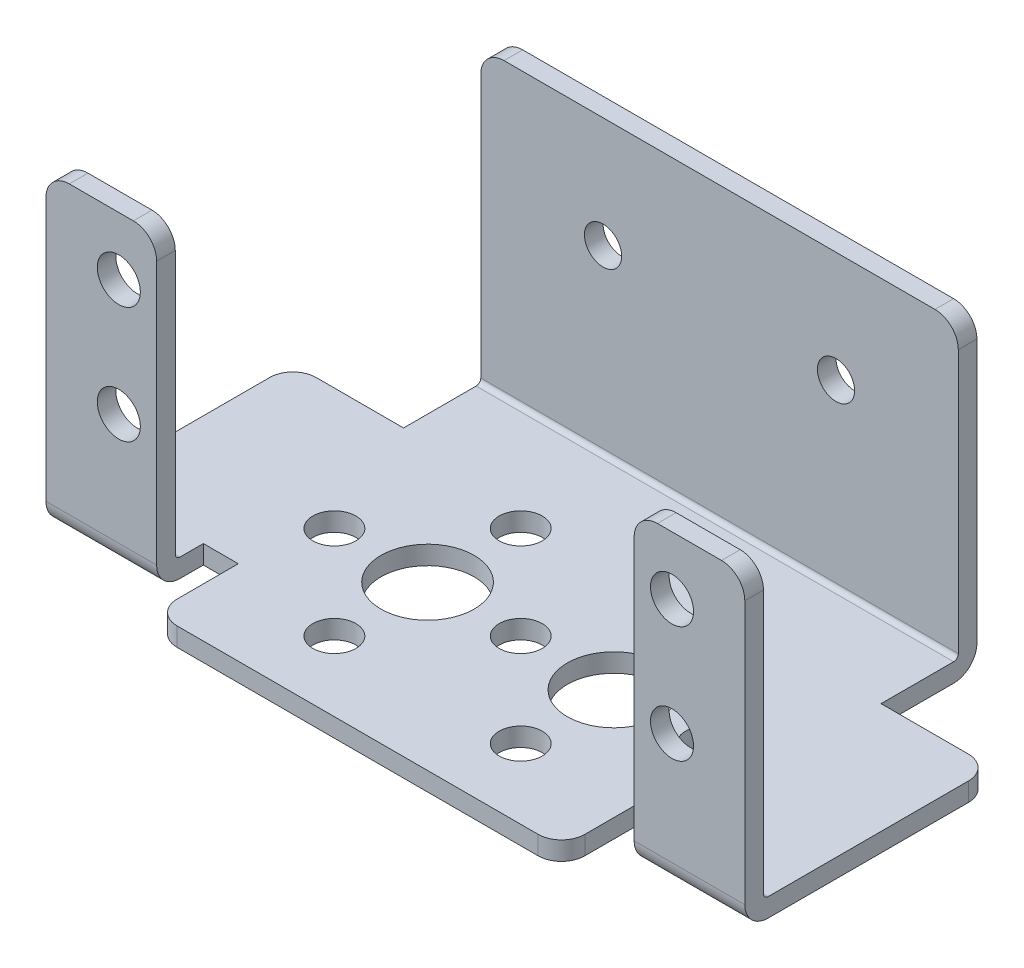
from build123d import *

# Parameters (mm, degrees)
SKETCH1_W                      = 26.6
SKETCH1_H                      = 29.43
BOSS_EXTRUDE1_DEPTH            = 9.5
SKETCH2_W                      = 27.83
SKETCH2_H                      = 25
CUT_EXTRUDE1_DEPTH             = 34.858217614
SKETCH3_W                      = 25.42
SKETCH3_H                      = 1.6
BOSS_EXTRUDE2_DEPTH            = 50.5
SKETCH4_W                      = 9.5
SKETCH4_H                      = 1.6
BOSS_EXTRUDE3_DEPTH            = 4.01
SKETCH5_W                      = 9.5
SKETCH5_H                      = 1.6
BOSS_EXTRUDE4_DEPTH            = 25
SKETCH6_W                      = 9.5
SKETCH6_H                      = 8.23
CUT_EXTRUDE2_DEPTH             = 44.284742115
SKETCH7_W                      = 9.5
SKETCH7_H                      = 8.23
CUT_EXTRUDE3_DEPTH             = 44.284742115
SKETCH8_W                      = 41
SKETCH8_H                      = 1.6
BOSS_EXTRUDE5_DEPTH            = 25
SKETCH9_W                      = 35
SKETCH9_H                      = 1.6
BOSS_EXTRUDE6_DEPTH            = 7.25
F_3_7_3_7_DIAMETER_HOLE1_D     = 3.7
F_3_7_3_7_DIAMETER_HOLE1_DEPTH = 26.6
F_8_0_8_DIAMETER_HOLE1_D       = 8
F_8_0_8_DIAMETER_HOLE1_DEPTH   = 26.6
F_3_2_3_2_DIAMETER_HOLE1_D     = 3.2
F_3_2_3_2_DIAMETER_HOLE1_DEPTH = 32.67
F_3_7_3_7_DIAMETER_HOLE2_D     = 3.7
F_3_7_3_7_DIAMETER_HOLE2_DEPTH = 29.43
FILLET1_R                      = 0.4
FILLET2_R                      = 2


with BuildPart() as part:
    # Sketch1 → Boss-Extrude1 (new body)
    with BuildSketch(Plane(origin=(-30, 0, 0), x_dir=(0, -1, 0), z_dir=(-1, 0, 0))):
        with Locations((-13.3, -3.955)):
            Rectangle(SKETCH1_W, SKETCH1_H)
    extrude(amount=-BOSS_EXTRUDE1_DEPTH)

    # Sketch2 → Cut-Extrude1 (cut, through all)
    with BuildSketch(Plane(origin=(-20.5, 0, 0), x_dir=(0, 0, -1), z_dir=(1, 0, 0))):
        with Locations((4.755, 14.1)):
            Rectangle(SKETCH2_W, SKETCH2_H)
    extrude(amount=-CUT_EXTRUDE1_DEPTH, mode=Mode.SUBTRACT)

    # Sketch3 → Boss-Extrude2 (add)
    with BuildSketch(Plane(origin=(-20.5, 0, 0), x_dir=(0, 0, -1), z_dir=(1, 0, 0))):
        with Locations((5.96, 0.8)):
            Rectangle(SKETCH3_W, SKETCH3_H)
    extrude(amount=BOSS_EXTRUDE2_DEPTH)

    # Sketch4 → Boss-Extrude3 (add)
    with BuildSketch(Plane.XY.offset(6.75)):
        with Locations((25.25, 0.8)):
            Rectangle(SKETCH4_W, SKETCH4_H)
    extrude(amount=BOSS_EXTRUDE3_DEPTH)

    # Sketch5 → Boss-Extrude4 (add)
    with BuildSketch(Plane(origin=(0, 1.6, 0), x_dir=(-1, 0, 0), z_dir=(0, 1, 0))):
        with Locations((-25.25, 9.96)):
            Rectangle(SKETCH5_W, SKETCH5_H)
    extrude(amount=BOSS_EXTRUDE4_DEPTH)

    # Sketch6 → Cut-Extrude2 (cut, through all)
    with BuildSketch(Plane(origin=(0, 1.6, 0), x_dir=(-1, 0, 0), z_dir=(0, 1, 0))):
        with Locations((25.25, -14.555)):
            Rectangle(SKETCH6_W, SKETCH6_H)
    extrude(amount=-CUT_EXTRUDE2_DEPTH, mode=Mode.SUBTRACT)

    # Sketch7 → Cut-Extrude3 (cut, through all)
    with BuildSketch(Plane(origin=(0, 1.6, 0), x_dir=(-1, 0, 0), z_dir=(0, 1, 0))):
        with Locations((-25.25, -14.555)):
            Rectangle(SKETCH7_W, SKETCH7_H)
    extrude(amount=-CUT_EXTRUDE3_DEPTH, mode=Mode.SUBTRACT)

    # Sketch8 → Boss-Extrude5 (add)
    with BuildSketch(Plane(origin=(0, 1.6, 0), x_dir=(-1, 0, 0), z_dir=(0, 1, 0))):
        with Locations((0, -17.87)):
            Rectangle(SKETCH8_W, SKETCH8_H)
    extrude(amount=BOSS_EXTRUDE5_DEPTH)

    # Sketch9 → Boss-Extrude6 (add)
    with BuildSketch(Plane.XY.offset(6.75)):
        with Locations((0, 0.8)):
            Rectangle(SKETCH9_W, SKETCH9_H)
    extrude(amount=BOSS_EXTRUDE6_DEPTH)

    # Ø3.7 (3.7) Diameter Hole1
    with Locations(Plane(origin=(0, 0, 0), x_dir=(-1, 0, 0), z_dir=(0, -1, 0))):
        with Locations((-16, 0), (-8, 8), (-8, -8), (16, 0), (8, 8), (8, -8), (0, 0)):
            Hole(F_3_7_3_7_DIAMETER_HOLE1_D / 2, depth=F_3_7_3_7_DIAMETER_HOLE1_DEPTH)

    # Ø8.0 (8) Diameter Hole1
    with Locations(Plane(origin=(0, 0, 0), x_dir=(-1, 0, 0), z_dir=(0, -1, 0))):
        with Locations((-8, 0), (8, 0)):
            Hole(F_8_0_8_DIAMETER_HOLE1_D / 2, depth=F_8_0_8_DIAMETER_HOLE1_DEPTH)

    # Ø3.2 (3.2) Diameter Hole1
    with Locations(Plane(origin=(0, 0, -18.67), x_dir=(-1, 0, 0), z_dir=(0, 0, -1))):
        with Locations((-10, 17.1), (10, 17.1)):
            Hole(F_3_2_3_2_DIAMETER_HOLE1_D / 2, depth=F_3_2_3_2_DIAMETER_HOLE1_DEPTH)

    # Ø3.7 (3.7) Diameter Hole2
    with Locations(Plane.XY.offset(10.76)):
        with Locations((-23.75, 11.6), (-23.75, 21.6), (23.75, 11.6), (23.75, 21.6)):
            Hole(F_3_7_3_7_DIAMETER_HOLE2_D / 2, depth=F_3_7_3_7_DIAMETER_HOLE2_DEPTH)

    # Fillet1
    fillet1_edges = [part.edges().sort_by_distance(p)[0] for p in [
        (0, 1.6, -17.07),
        (-25.25, 1.6, 9.16),
        (25.25, 1.6, 9.16),
    ]]
    fillet(fillet1_edges, radius=FILLET1_R)

    # Fillet2
    fillet2_edges = [part.edges().sort_by_distance(p)[0] for p in [
        (20.5, 26.6, -17.87),
        (-20.5, 26.6, -17.87),
        (17.5, 0.8, 14),
        (-17.5, 0.8, 14),
        (25.25, 0, 10.76),
        (-30, 26.6, 9.96),
        (30, 26.6, 9.96),
        (20.5, 26.6, 9.96),
        (-30, 0.8, -10.44),
        (-20.5, 26.6, 9.96),
        (-25.25, 0, 10.76),
        (30, 0.8, -10.44),
        (0, 0, -18.67),
    ]]
    fillet(fillet2_edges, radius=FILLET2_R)


solid = part.part
